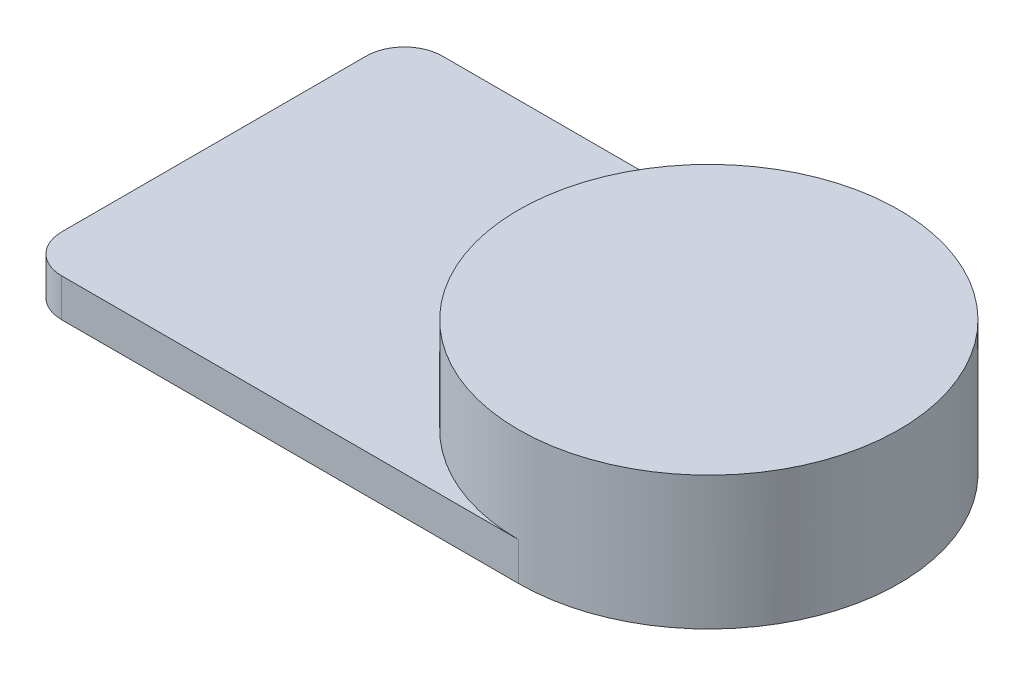
from build123d import *

# Parameters (mm, degrees)
BOSS_EXTRUDE8_DEPTH = 10
SKETCH8_R           = 50
BOSS_EXTRUDE9_DEPTH = 25
SKETCH9_R           = 5
CUT_EXTRUDE8_DEPTH  = 5
FILLET1_R           = 10


with BuildPart() as part:
    # Sketch1 → Boss-Extrude8 (new body)
    with BuildSketch(Plane(origin=(0, 0, 0), x_dir=(1, 0, 0), z_dir=(0, 1, 0))):
        with BuildLine():
            ThreePointArc((50, 0), (35.355339059, 35.355339059), (0, 50))
            Line((0, 50), (0, -50))
            ThreePointArc((0, -50), (35.355339059, -35.355339059), (50, 0))
        make_face()
        with BuildLine():
            Line((0, -50), (0, 50))
            ThreePointArc((0, 50), (-50, 0), (0, -50))
        make_face()
        with BuildLine():
            ThreePointArc((0, -50), (-50, 0), (0, 50))
            Line((0, 50), (-130, 50))
            Line((-130, 50), (-130, -50))
            Line((-130, -50), (0, -50))
        make_face()
    extrude(amount=BOSS_EXTRUDE8_DEPTH)

    # Sketch8 → Boss-Extrude9 (add)
    with BuildSketch(Plane(origin=(0, 10, 0), x_dir=(1, 0, 0), z_dir=(0, 1, 0))):
        with Locations(Location((0, 0, 0), (0, 0, 270))):
            Circle(SKETCH8_R)
    extrude(amount=BOSS_EXTRUDE9_DEPTH)

    # Sketch9 → Cut-Extrude8 (cut)
    with BuildSketch(Plane.XZ):
        with Locations(Location((-15, 40, 0), (0, 0, 270))):
            Circle(SKETCH9_R)
        with Locations(Location((-15, -40, 0), (0, 0, 270))):
            Circle(SKETCH9_R)
        with Locations(Location((-115, -40, 0), (0, 0, 270))):
            Circle(SKETCH9_R)
        with Locations(Location((-115, 40, 0), (0, 0, 270))):
            Circle(SKETCH9_R)
    extrude(amount=-CUT_EXTRUDE8_DEPTH, mode=Mode.SUBTRACT)

    # Fillet1
    fillet1_edges = [part.edges().sort_by_distance(p)[0] for p in [
        (-130, 5, 50),
        (-130, 5, -50),
    ]]
    fillet(fillet1_edges, radius=FILLET1_R)


solid = part.part
